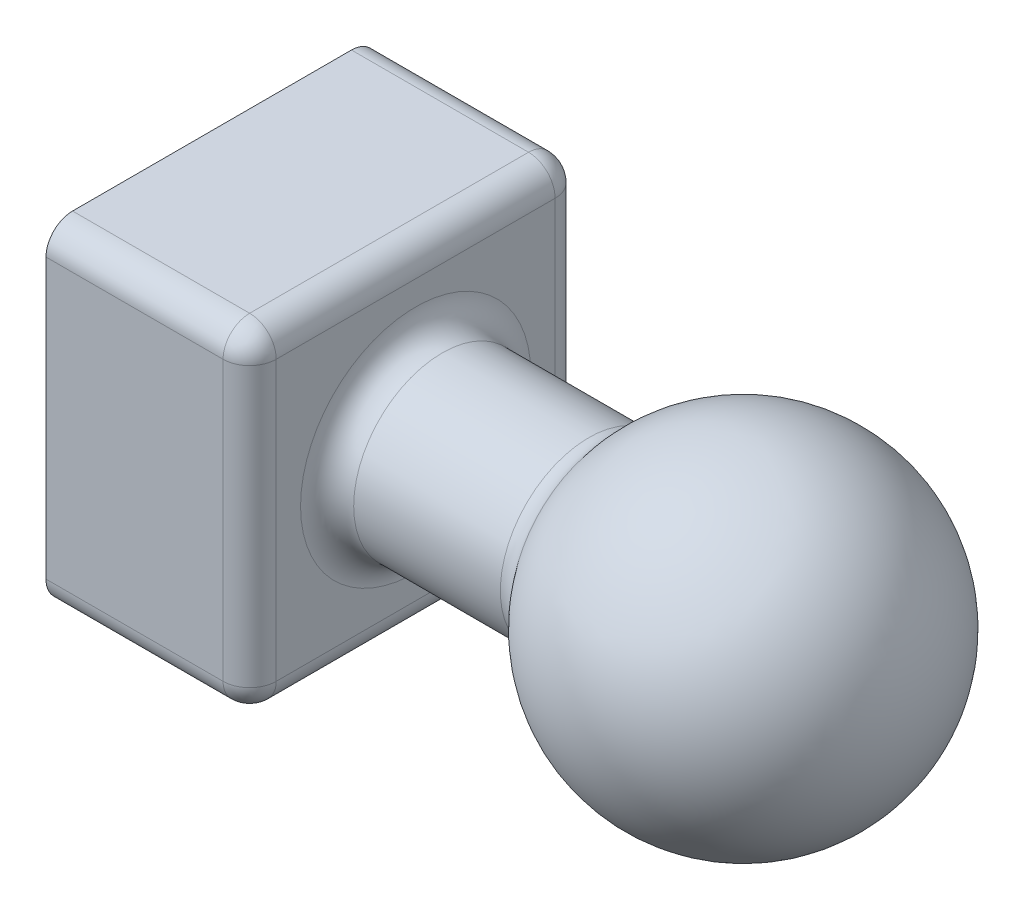
from build123d import *

# Parameters (mm, degrees)
SKETCH2_W           = 37.5
SKETCH2_H           = 37.5
SKETCH2_R           = 15
BOSS_EXTRUDE1_DEPTH = 23
SKETCH3_R           = 15
BOSS_EXTRUDE2_DEPTH = 3
FILLET2_R           = 3
FILLET3_R           = 2


with BuildPart() as part:
    # Sketch1 → Revolve1 (revolve)
    with BuildSketch(Plane.XY, mode=Mode.PRIVATE) as revolve1_sk:
        with BuildLine():
            Line((0, 10), (21.139278074, 10))
            ThreePointArc((21.139278074, 10), (42.204515534, 18.013203992), (55.75, 0))
            Line((55.75, 0), (0, 0))
            Line((0, 0), (0, 10))
        make_face()
    revolve(revolve1_sk.sketch.rotate(Axis((55.75, 0, 0), (-1, 0, 0)), 180), axis=Axis((55.75, 0, 0), (-1, 0, 0)))



with BuildPart() as body_2:
    # Sketch2 → Boss-Extrude1 (new body)
    with BuildSketch(Plane.ZY):
        Rectangle(SKETCH2_W, SKETCH2_H)
        Circle(SKETCH2_R, mode=Mode.SUBTRACT)
    extrude(amount=BOSS_EXTRUDE1_DEPTH)


with BuildPart() as part_1:
    add(part.part)

    add(body_2.part)  # Boss-Extrude2 merges body 2
    # Sketch3 → Boss-Extrude2 (add)
    with BuildSketch(Plane.ZY):
        Circle(SKETCH3_R)
    extrude(amount=BOSS_EXTRUDE2_DEPTH)

    # Fillet2
    fillet2_edges = [part_1.edges().sort_by_distance(p)[0] for p in [
        (0, 10, 0),
        (0, 0, 18.75),
        (-11.5, -18.75, 18.75),
        (0, 18.75, 0),
        (-11.5, 18.75, 18.75),
        (0, 0, -18.75),
        (-11.5, 18.75, -18.75),
        (0, -18.75, 0),
        (-11.5, -18.75, -18.75),
        (21.139278074, 10, 0),
    ]]
    fillet(fillet2_edges, radius=FILLET2_R)

    # Fillet3
    fillet3_edges = [part_1.edges().sort_by_distance(p)[0] for p in [
        (-23, 0, -15),
    ]]
    fillet(fillet3_edges, radius=FILLET3_R)


solid = part_1.part
